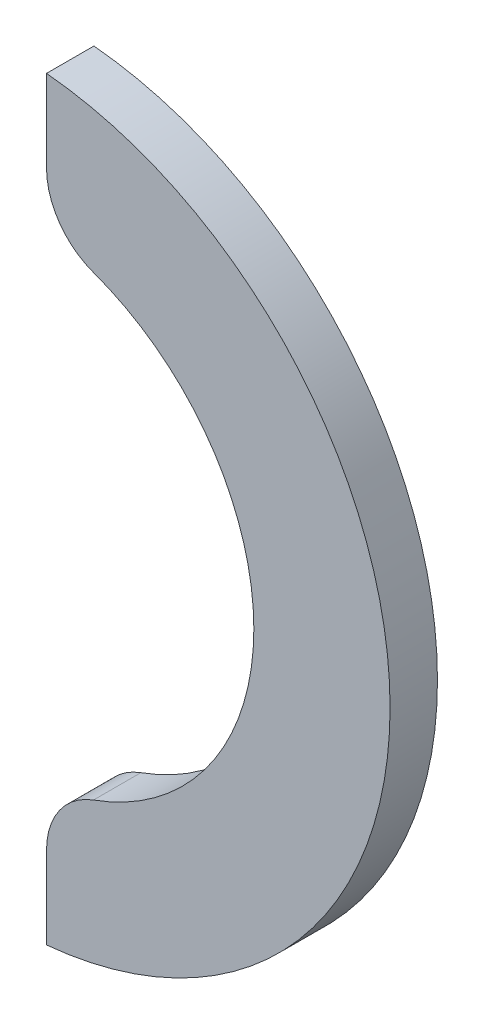
from build123d import *

# Parameters (mm, degrees)
SKETCH_1_R               = 16
SKETCH_1_R_2             = 10.25
EXTRUDE_1_DEPTH          = 2
CUT_EXTRUDE_1_DEPTH      = 23.715633383
CUT_EXTRUDE_1_DEPTH_BACK = 23.715633383
FILLET_1_R               = 3


with BuildPart() as part:
    # 草图1 → 凸台-拉伸1 (new body)
    with BuildSketch(Plane.XY):
        Circle(SKETCH_1_R)
        Circle(SKETCH_1_R_2, mode=Mode.SUBTRACT)
    extrude(amount=EXTRUDE_1_DEPTH)

    # 草图2 → 切除-拉伸1 (cut, two sides: drawn at the far end of the back side and taken through both)
    with BuildSketch(Plane.XY.offset(2).offset(-CUT_EXTRUDE_1_DEPTH_BACK)):
        Polygon((1.5, 125.288041533), (1.5, 21.206511883), (1.5, -27.664442689), (1.5, -131.74597234), (-206.663059302, -131.74597234), (-206.663059302, 125.288041533), align=None)
    extrude(amount=CUT_EXTRUDE_1_DEPTH + CUT_EXTRUDE_1_DEPTH_BACK, mode=Mode.SUBTRACT)

    # 圆角1
    fillet_1_edges = [part.edges().sort_by_distance(p)[0] for p in [
        (1.5, 10.139649895, 1),
        (1.5, -10.139649895, 1),
    ]]
    fillet(fillet_1_edges, radius=FILLET_1_R)


solid = part.part
